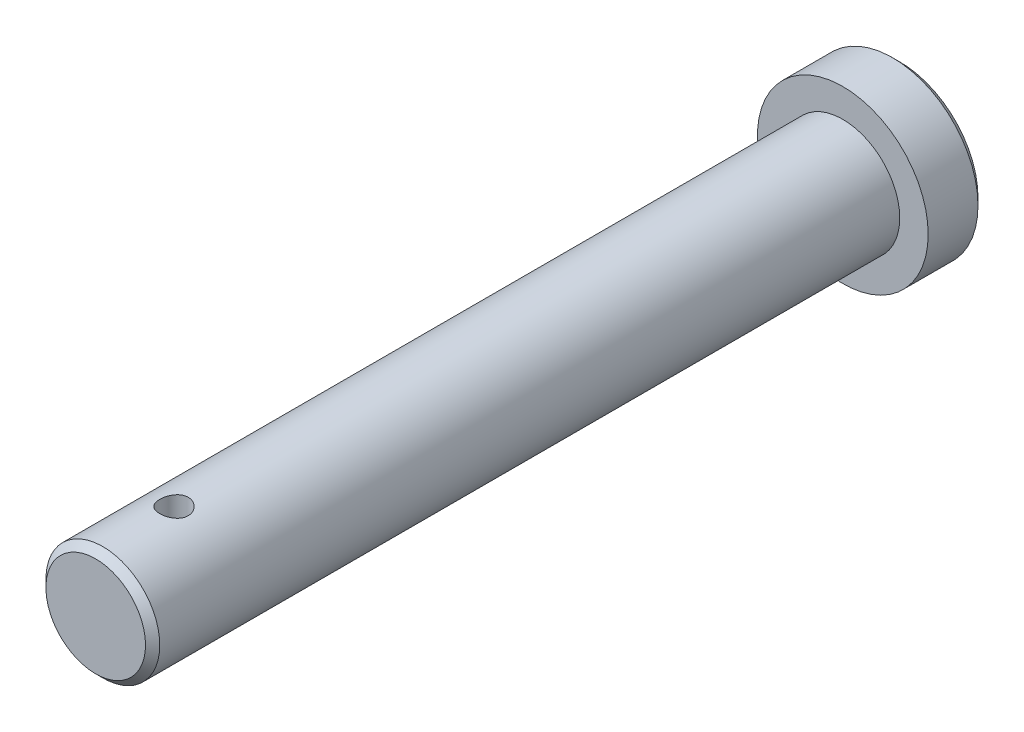
from build123d import *

# Parameters (mm, degrees)
SKETCH1_R           = 12
BOSS_EXTRUDE1_DEPTH = 8
CHAMFER2_SIZE       = 1
SKETCH2_R           = 8
BOSS_EXTRUDE2_DEPTH = 105
CHAMFER3_SIZE       = 1
SKETCH3_R           = 2
CUT_EXTRUDE1_DEPTH  = 17.5


with BuildPart() as part:
    # Sketch1 → Boss-Extrude1 (new body)
    with BuildSketch(Plane.XY):
        Circle(SKETCH1_R)
    extrude(amount=BOSS_EXTRUDE1_DEPTH)

    # Chamfer2
    chamfer2_edges = [part.edges().sort_by_distance(p)[0] for p in [
        (-12, 0, 0),
    ]]
    chamfer(chamfer2_edges, length=CHAMFER2_SIZE)

    # Sketch2 → Boss-Extrude2 (add)
    with BuildSketch(Plane.XY.offset(8)):
        Circle(SKETCH2_R)
    extrude(amount=BOSS_EXTRUDE2_DEPTH)

    # Chamfer3
    chamfer3_edges = [part.edges().sort_by_distance(p)[0] for p in [
        (-8, 0, 113),
    ]]
    chamfer(chamfer3_edges, length=CHAMFER3_SIZE)

    # Sketch3 → Cut-Extrude1 (cut, symmetric)
    with BuildSketch(Plane(origin=(0, 0, 0), x_dir=(1, 0, 0), z_dir=(0, 1, 0))):
        with Locations(Location((0, -102, 0), (0, 0, 270))):
            Circle(SKETCH3_R)
    extrude(amount=CUT_EXTRUDE1_DEPTH, both=True, mode=Mode.SUBTRACT)


solid = part.part
